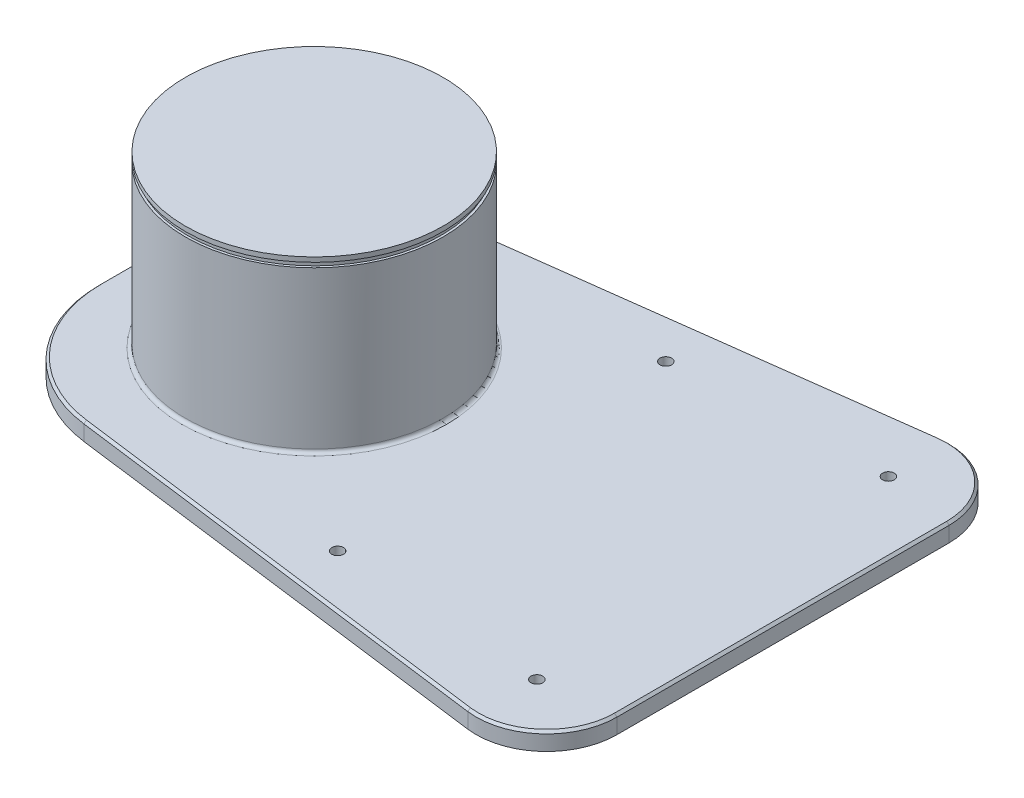
from build123d import *

# Parameters (mm, degrees)
BOSS_EXTRU_1_DEPTH      = 15
ESQUISSE2_R             = 110
BOSS_EXTRU_2_DEPTH      = 145
ESQUISSE3_R             = 111
ESQUISSE3_R_2           = 108
ENL_V_MAT_EXTRU_1_DEPTH = 4
ESQUISSE4_R             = 5
ENL_V_MAT_EXTRU_2_DEPTH = 471.867329483
CONG_1_R                = 3
CHANFREIN1_SIZE         = 2


with BuildPart() as part:
    # Esquisse1 → Boss.-Extru.1 (new body)
    with BuildSketch(Plane(origin=(0, 0, 0), x_dir=(1, 0, 0), z_dir=(0, 1, 0))):
        with BuildLine():
            Line((-140, 43.338898303), (-140, -43.338898303))
            ThreePointArc((-140, -43.338898303), (-112.630211626, -115.949146387), (-44.140943151, -152.426174036))
            Line((-44.140943151, -152.426174036), (332.286758282, -201.222357555))
            ThreePointArc((332.286758282, -201.222357555), (379.605589864, -186.791231678), (400, -141.720207155))
            Line((400, -141.720207155), (400, 141.720207155))
            ThreePointArc((400, 141.720207155), (379.605589864, 186.791231678), (332.286758282, 201.222357555))
            Line((332.286758282, 201.222357555), (-44.140943151, 152.426174036))
            ThreePointArc((-44.140943151, 152.426174036), (-112.630211626, 115.949146387), (-140, 43.338898303))
        make_face()
    extrude(amount=BOSS_EXTRU_1_DEPTH)

    # Esquisse2 → Boss.-Extru.2 (add)
    with BuildSketch(Plane(origin=(0, 15, 0), x_dir=(1, 0, 0), z_dir=(0, 1, 0))):
        Circle(ESQUISSE2_R)
    extrude(amount=BOSS_EXTRU_2_DEPTH)

    # Esquisse3 → Enlèv. mat.-Extru.1 (cut)
    with BuildSketch(Plane(origin=(0, 156, 0), x_dir=(1, 0, 0), z_dir=(0, 1, 0))):
        Circle(ESQUISSE3_R)
        Circle(ESQUISSE3_R_2, mode=Mode.SUBTRACT)
    extrude(amount=-ENL_V_MAT_EXTRU_1_DEPTH, mode=Mode.SUBTRACT)

    # Esquisse4 → Enlèv. mat.-Extru.2 (cut, through all)
    with BuildSketch(Plane(origin=(0, 15, 0), x_dir=(1, 0, 0), z_dir=(0, 1, 0))):
        with Locations((340, -150)):
            Circle(ESQUISSE4_R)
        with Locations((340, 150)):
            Circle(ESQUISSE4_R)
        with Locations((160, -140)):
            Circle(ESQUISSE4_R)
        with Locations((160, 140)):
            Circle(ESQUISSE4_R)
    extrude(amount=-ENL_V_MAT_EXTRU_2_DEPTH, mode=Mode.SUBTRACT)

    # Congé1
    cong_1_edges = [part.edges().sort_by_distance(p)[0] for p in [
        (-110, 15, 0),
    ]]
    fillet(cong_1_edges, radius=CONG_1_R)

    # Chanfrein1
    chanfrein1_edges = [part.edges().sort_by_distance(p)[0] for p in [
        (379.605589864, 15, 186.791231678),
        (400, 15, 0),
        (144.072907565, 15, 176.824265796),
        (379.605589864, 15, -186.791231678),
        (-112.630211626, 15, 115.949146387),
        (144.072907565, 15, -176.824265796),
        (-140, 15, 0),
        (-112.630211626, 15, -115.949146387),
    ]]
    chamfer(chanfrein1_edges, length=CHANFREIN1_SIZE)


solid = part.part
